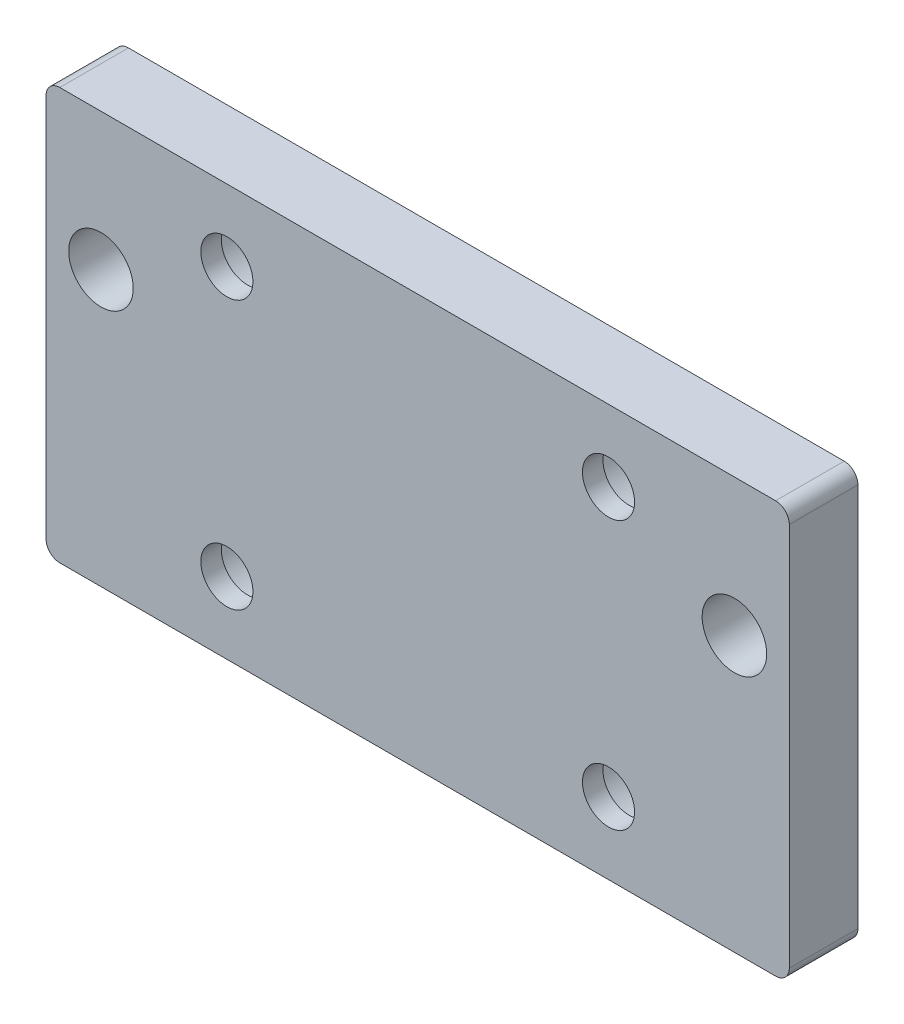
from build123d import *

# Parameters (mm, degrees)
SKETCH1_W                                      = 54.161
SKETCH1_H                                      = 30
BOSS_EXTRUDE1_DEPTH                            = 5
M4_CLEARANCE_HOLE1_D                           = 4.7
FILLET1_R                                      = 1
CBORE_FOR_6_SOCKET_HEAD_CAP_SCREW1_D           = 3.7973
CBORE_FOR_6_SOCKET_HEAD_CAP_SCREW1_CBORE_D     = 7.14502
CBORE_FOR_6_SOCKET_HEAD_CAP_SCREW1_CBORE_DEPTH = 3.5052


with BuildPart() as part:
    # Sketch1 → Boss-Extrude1 (new body)
    with BuildSketch(Plane.XY):
        with Locations((27.0805, 15)):
            Rectangle(SKETCH1_W, SKETCH1_H)
    extrude(amount=BOSS_EXTRUDE1_DEPTH)

    # M4 Clearance Hole1 (through all)
    with Locations(Plane.XY.offset(5)):
        with Locations((4, 20), (50.161, 20)):
            Hole(M4_CLEARANCE_HOLE1_D / 2)

    # Fillet1
    fillet1_edges = [part.edges().sort_by_distance(p)[0] for p in [
        (0, 30, 2.5),
        (54.161, 30, 2.5),
        (54.161, 0, 2.5),
        (0, 0, 2.5),
    ]]
    fillet(fillet1_edges, radius=FILLET1_R)

    # CBORE for #6 Socket Head Cap Screw1 (through all)
    with Locations(Plane(origin=(0, 0, 0), x_dir=(-1, 0, 0), z_dir=(0, 0, -1))):
        with Locations((-40.986, 24.779), (-13.175, 24.779), (-40.986, 5.221), (-13.175, 5.221)):
            CounterBoreHole(CBORE_FOR_6_SOCKET_HEAD_CAP_SCREW1_D / 2, CBORE_FOR_6_SOCKET_HEAD_CAP_SCREW1_CBORE_D / 2, CBORE_FOR_6_SOCKET_HEAD_CAP_SCREW1_CBORE_DEPTH)


solid = part.part
